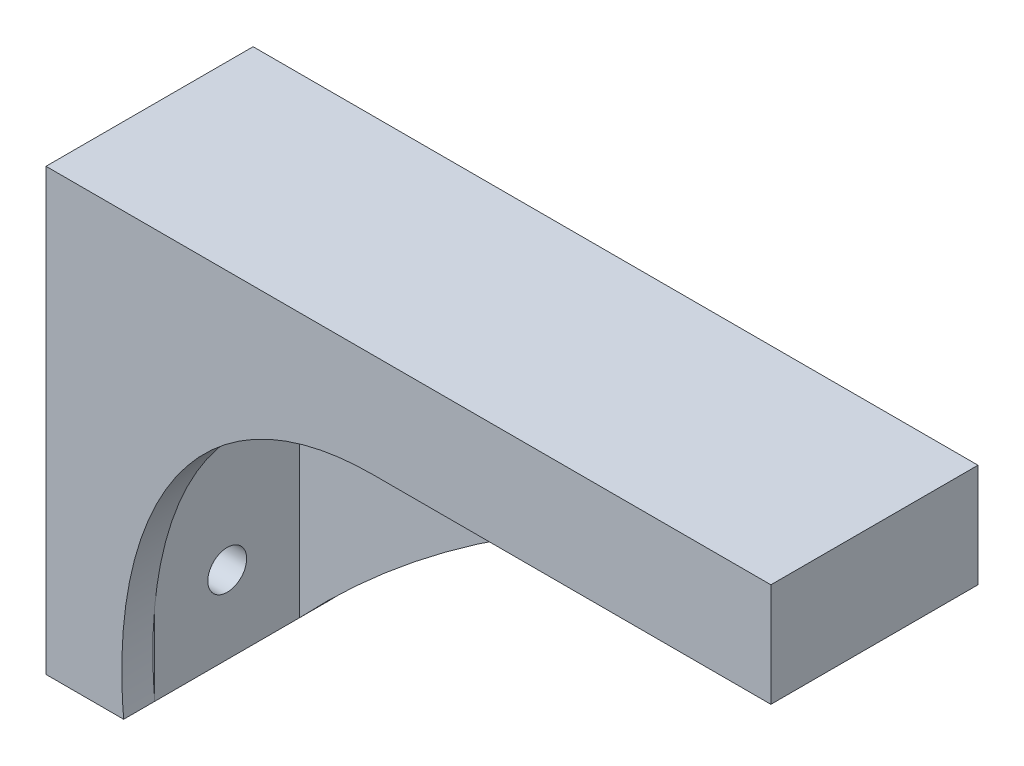
from build123d import *

# Parameters (mm, degrees)
BOSS_EXTRUDE1_DEPTH                                 = 50.8
F_8_CLEARANCE_HOLE1_D                               = 4.4958
CBORE_FOR_8_BINDING_HEAD_MACHINE_SCREW1_D           = 4.4958
CBORE_FOR_8_BINDING_HEAD_MACHINE_SCREW1_CBORE_D     = 9.525
CBORE_FOR_8_BINDING_HEAD_MACHINE_SCREW1_CBORE_DEPTH = 12.7
BOSS_EXTRUDE2_DEPTH                                 = 7.62
CUT_EXTRUDE1_DEPTH                                  = 7.62


with BuildPart() as part:
    # Sketch1 → Boss-Extrude1 (new body)
    with BuildSketch(Plane.XY):
        Polygon((0, 0), (0, -107.95), (19.05, -107.95), (19.05, -25.4), (177.8, -25.4), (177.8, 0), align=None)
    extrude(amount=BOSS_EXTRUDE1_DEPTH)

    # #8 Clearance Hole1 (through all)
    with Locations(Plane.ZY):
        with Locations((25.4, -31.75), (25.4, -88.9)):
            Hole(F_8_CLEARANCE_HOLE1_D / 2)

    # CBORE for #8 Binding Head Machine Screw1 (through all)
    with Locations(Plane(origin=(19.05, 0, 0), x_dir=(0, 0, -1), z_dir=(1, 0, 0))):
        with Locations((-25.4, -31.75), (-25.4, -88.9)):
            CounterBoreHole(CBORE_FOR_8_BINDING_HEAD_MACHINE_SCREW1_D / 2, CBORE_FOR_8_BINDING_HEAD_MACHINE_SCREW1_CBORE_D / 2, CBORE_FOR_8_BINDING_HEAD_MACHINE_SCREW1_CBORE_DEPTH)

    # Sketch7 → Boss-Extrude2 (add)
    with BuildSketch(Plane.XY.offset(50.8)):
        with BuildLine():
            Line((19.05, -107.95), (19.05, -25.4))
            Line((19.05, -25.4), (177.8, -25.4))
            ThreePointArc((177.8, -25.4), (91.430997476, -53.224995146), (19.05, -107.95))
        make_face()
    boss_extrude2 = extrude(amount=-BOSS_EXTRUDE2_DEPTH)

    # Mirror1: Boss-Extrude2 across plane
    add(boss_extrude2.mirror(Plane(origin=(0, 0, 25.4), x_dir=(1, 0, 0), z_dir=(0, 0, -1))))

    # Sketch8 → Cut-Extrude1 (cut)
    with BuildSketch(Plane.XY.offset(50.8)):
        with BuildLine():
            Line((177.8, -25.4), (80.273648103, -25.4))
            add(Edge.make_bspline(
                [(80.273648103, -25.4), (36.871479527, -25.4), (15.065136677, -63.527261514), (19.05, -107.95)],
                knots=[0, 0, 0, 0, 1, 1, 1, 1], degree=3))
            Line((19.05, -107.95), (177.8, -25.4))
        make_face()
    extrude(amount=-CUT_EXTRUDE1_DEPTH, mode=Mode.SUBTRACT)


solid = part.part
